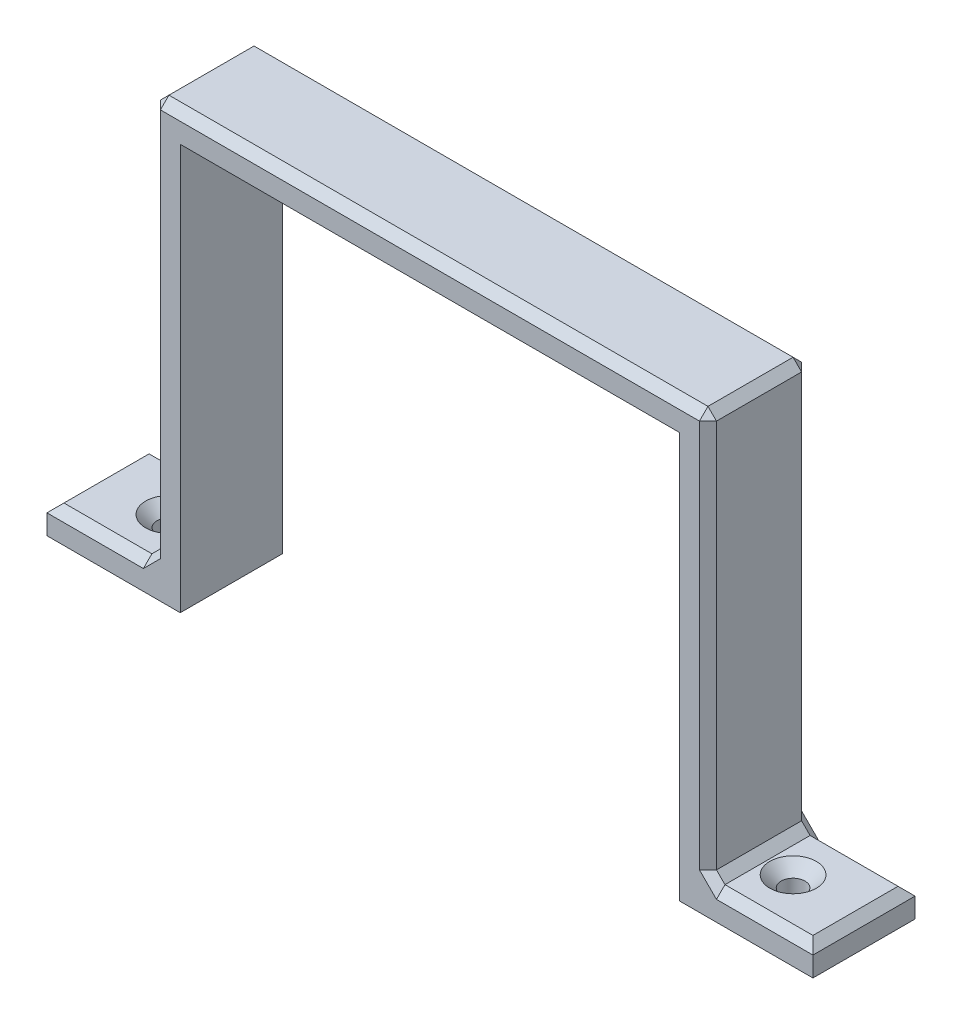
from build123d import *

# Parameters (mm, degrees)
BOSS_EXTRUDE1_DEPTH = 9
SKETCH2_R           = 2.1
CUT_EXTRUDE1_DEPTH  = 9
CHAMFER1_SIZE       = 2
CHAMFER2_SIZE       = 1.5


with BuildPart() as part:
    # Sketch1 → Boss-Extrude1 (new, symmetric)
    with BuildSketch(Plane.XY):
        Polygon((44, -27.85), (44, 43.65), (-44, 43.65), (-44, -27.85), (-67.5, -27.85), (-67.5, -22.85), (-49, -22.85), (-49, 48.65), (49, 48.65), (49, -22.85), (67.5, -22.85), (67.5, -27.85), align=None)
    extrude(amount=BOSS_EXTRUDE1_DEPTH, both=True)

    # Sketch2 → Cut-Extrude1 (cut, symmetric)
    with BuildSketch(Plane.XZ.offset(27.85)):
        with Locations(Location((55, 0, 0), (0, 0, 270))):
            Circle(SKETCH2_R)
        with Locations(Location((-55, 0, 0), (0, 0, 180))):
            Circle(SKETCH2_R)
    extrude(amount=CUT_EXTRUDE1_DEPTH, both=True, mode=Mode.SUBTRACT)

    # Chamfer1
    chamfer1_edges = [part.edges().sort_by_distance(p)[0] for p in [
        (55, -22.85, 2.1),
        (-52.9, -22.85, 0),
    ]]
    chamfer(chamfer1_edges, length=CHAMFER1_SIZE)

    # Chamfer2
    chamfer2_edges = [part.edges().sort_by_distance(p)[0] for p in [
        (58.25, -22.85, 9),
        (-58.25, -22.85, -9),
        (-49, 12.9, -9),
        (0, 48.65, -9),
        (49, 12.9, -9),
        (58.25, -22.85, -9),
        (49, 12.9, 9),
        (0, 48.65, 9),
        (-67.5, -22.85, 0),
        (-49, -22.85, 0),
        (-49, 48.65, 0),
        (49, 48.65, 0),
        (49, -22.85, 0),
        (67.5, -22.85, 0),
        (-49, 12.9, 9),
        (-58.25, -22.85, 9),
    ]]
    chamfer(chamfer2_edges, length=CHAMFER2_SIZE)


solid = part.part
